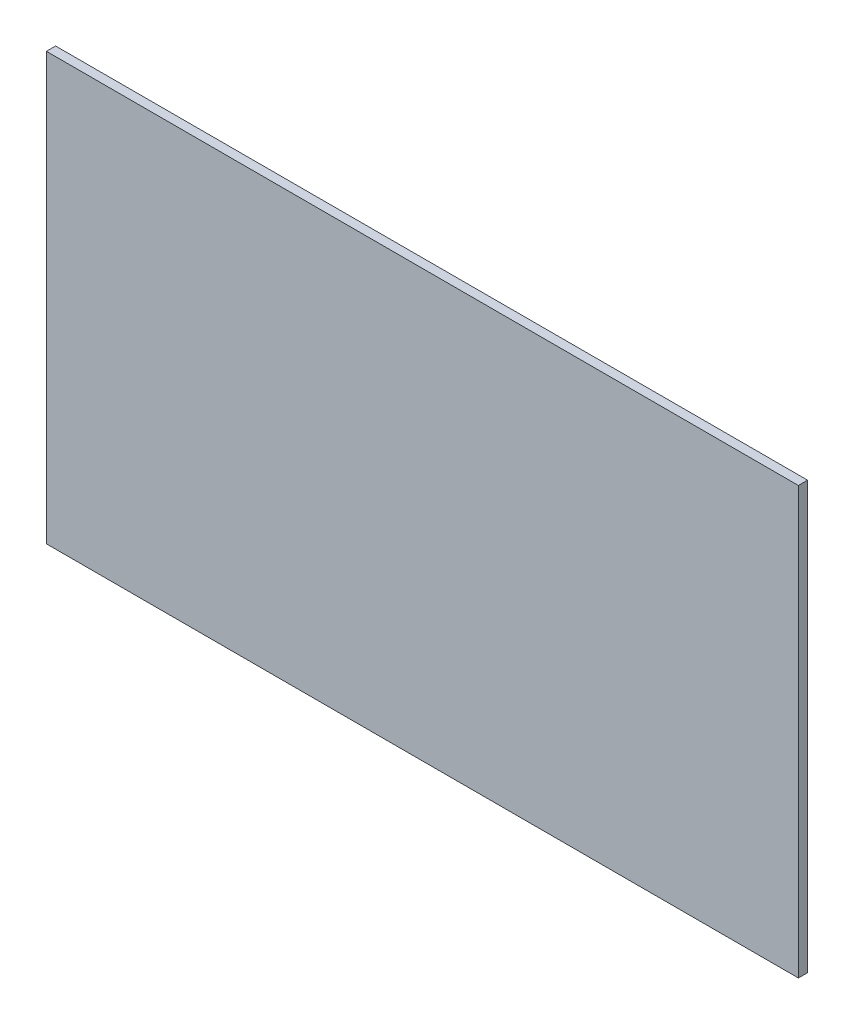
from build123d import *

# Parameters (mm, degrees)
SKETCH1_W           = 2045
SKETCH1_H           = 1160
BOSS_EXTRUDE1_DEPTH = 25


with BuildPart() as part:
    # Sketch1 → Boss-Extrude1 (new body)
    with BuildSketch(Plane.XY):
        with Locations((1022.5, 580)):
            Rectangle(SKETCH1_W, SKETCH1_H)
    extrude(amount=BOSS_EXTRUDE1_DEPTH)


solid = part.part
